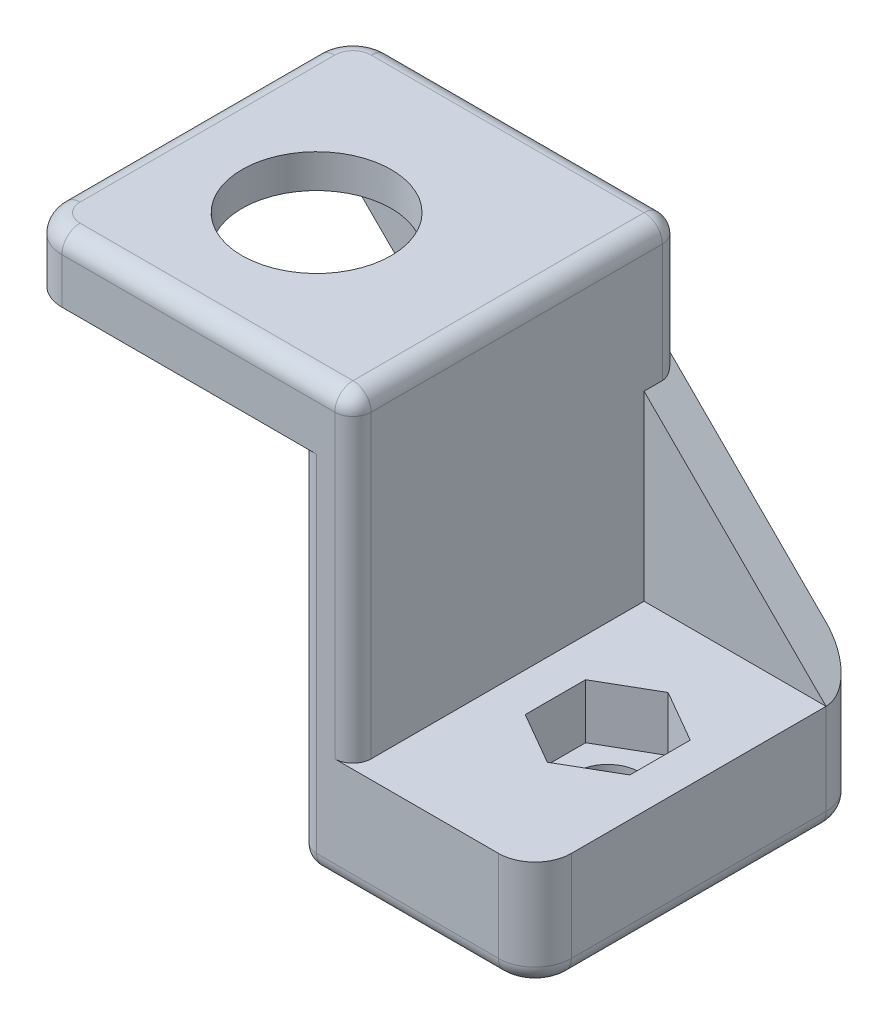
from build123d import *

# Parameters (mm, degrees)
BOSS_EXTRUDE1_DEPTH = 36
SKETCH3_R           = 3.5
CUT_EXTRUDE1_DEPTH  = 32
SKETCH2_R           = 8.2
CUT_EXTRUDE2_DEPTH  = 32
CUT_EXTRUDE3_DEPTH  = 6
BOSS_EXTRUDE3_DEPTH = 4
CUT_EXTRUDE4_DEPTH  = 3.3
FILLET1_R           = 4
FILLET4_R           = 2


with BuildPart() as part:
    # Sketch1 → Boss-Extrude1 (new body)
    with BuildSketch(Plane.XY):
        Polygon((0, 0), (0, 40), (-30, 40), (-30, 47), (6, 47), (6, 12), (26, 12), (26, 0), align=None)
    extrude(amount=BOSS_EXTRUDE1_DEPTH)

    # Sketch3 → Cut-Extrude1 (cut)
    with BuildSketch(Plane(origin=(0, 12, 0), x_dir=(1, 0, 0), z_dir=(0, 1, 0))):
        with Locations(Location((16, -18, 0), (0, 0, 270))):
            Circle(SKETCH3_R)
    extrude(amount=-CUT_EXTRUDE1_DEPTH, mode=Mode.SUBTRACT)

    # Sketch2 → Cut-Extrude2 (cut)
    with BuildSketch(Plane(origin=(0, 47, 0), x_dir=(1, 0, 0), z_dir=(0, 1, 0))):
        with Locations(Location((-14, -20, 0), (0, 0, 270))):
            Circle(SKETCH2_R)
    extrude(amount=-CUT_EXTRUDE2_DEPTH, mode=Mode.SUBTRACT)

    # Sketch4 → Cut-Extrude3 (cut)
    with BuildSketch(Plane(origin=(0, 12, 0), x_dir=(1, 0, 0), z_dir=(0, 1, 0))):
        Polygon((16, -24.639528096), (21.75, -21.319764048), (21.75, -14.680235952), (16, -11.360471904), (10.25, -14.680235952), (10.25, -21.319764048), align=None)
    extrude(amount=-CUT_EXTRUDE3_DEPTH, mode=Mode.SUBTRACT)

    # Sketch5 → Boss-Extrude3 (add)
    with BuildSketch(Plane(origin=(0, 0, 0), x_dir=(-1, 0, 0), z_dir=(0, 0, -1))):
        Polygon((-26, 12), (-6, 32), (-6, 12), align=None)
        Polygon((0, 10), (0, 40), (30, 40), align=None)
    extrude(amount=-BOSS_EXTRUDE3_DEPTH)

    # Sketch6 → Cut-Extrude4 (cut)
    with BuildSketch(Plane.XZ.offset(-40)):
        Polygon((-14, 4.988893001), (-1, 12.494446501), (-1, 27.505553499), (-14, 35.011106999), (-27, 27.505553499), (-27, 12.494446501), align=None)
    extrude(amount=-CUT_EXTRUDE4_DEPTH, mode=Mode.SUBTRACT)

    # Fillet1
    fillet1_edges = [part.edges().sort_by_distance(p)[0] for p in [
        (26, 6, 0),
        (-30, 43.5, 36),
        (26, 6, 36),
        (-30, 43.5, 0),
    ]]
    fillet(fillet1_edges, radius=FILLET1_R)

    # Fillet4
    fillet4_edges = [part.edges().sort_by_distance(p)[0] for p in [
        (26, 0, 18),
        (24.828427125, 0, 1.171572875),
        (24.828427125, 0, 34.828427125),
        (-30, 47, 18),
        (11, 0, 0),
        (-28.828427125, 47, 1.171572875),
        (-28.828427125, 47, 34.828427125),
        (0, 0, 18),
        (6, 47, 18),
        (6, 29.5, 36),
        (-10, 47, 36),
        (0, 20, 36),
        (11, 0, 36),
        (6, 39.5, 0),
        (-10, 47, 0),
    ]]
    fillet(fillet4_edges, radius=FILLET4_R)


solid = part.part
